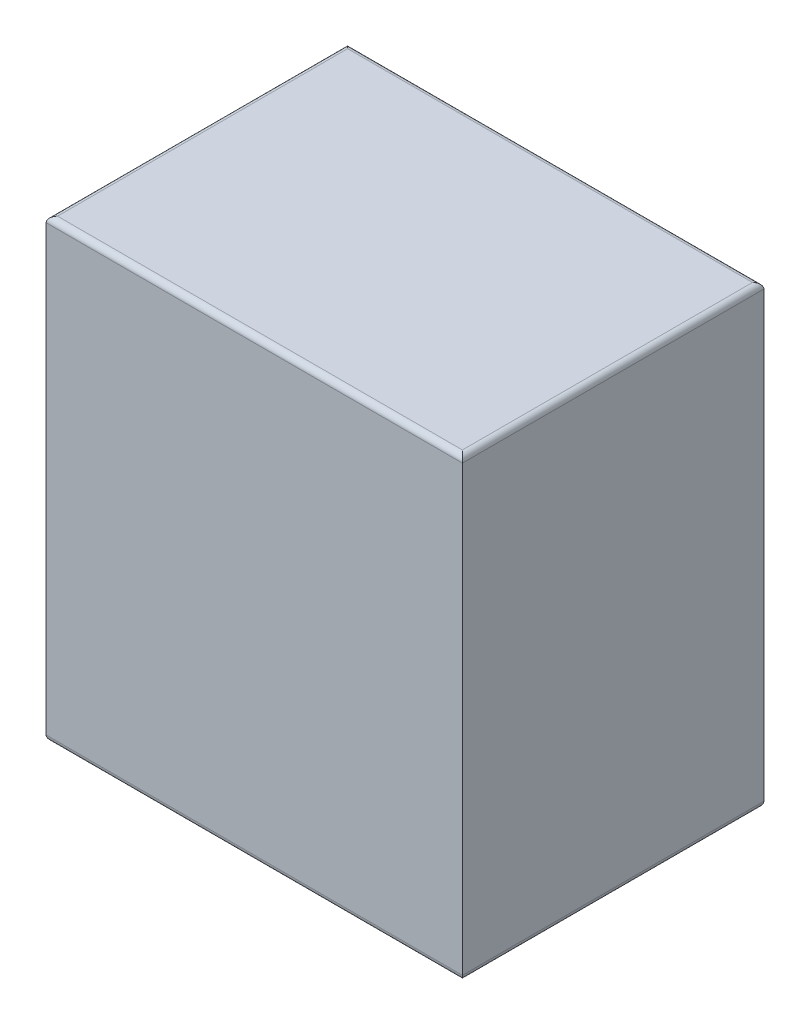
from build123d import *

# Parameters (mm, degrees)
SKETCH1_W           = 36.6
SKETCH1_H           = 26.5
BOSS_EXTRUDE1_DEPTH = 40
FILLET1_R           = 0.5


with BuildPart() as part:
    # Sketch1 → Boss-Extrude1 (new body)
    with BuildSketch(Plane(origin=(0, 0, 0), x_dir=(-1, 0, 0), z_dir=(0, 1, 0))):
        with Locations((-18.70000038, -13.680000271)):
            Rectangle(SKETCH1_W, SKETCH1_H)
    extrude(amount=BOSS_EXTRUDE1_DEPTH)

    # Fillet1
    fillet1_edges = [part.edges().sort_by_distance(p)[0] for p in [
        (18.70000038, 40, -26.930000271),
        (0.40000038, 40, -13.680000271),
        (18.70000038, 40, -0.430000271),
        (0.40000038, 0, -13.680000271),
        (18.70000038, 0, -26.930000271),
        (37.00000038, 0, -13.680000271),
        (18.70000038, 0, -0.430000271),
        (37.00000038, 40, -13.680000271),
    ]]
    fillet(fillet1_edges, radius=FILLET1_R)


solid = part.part
